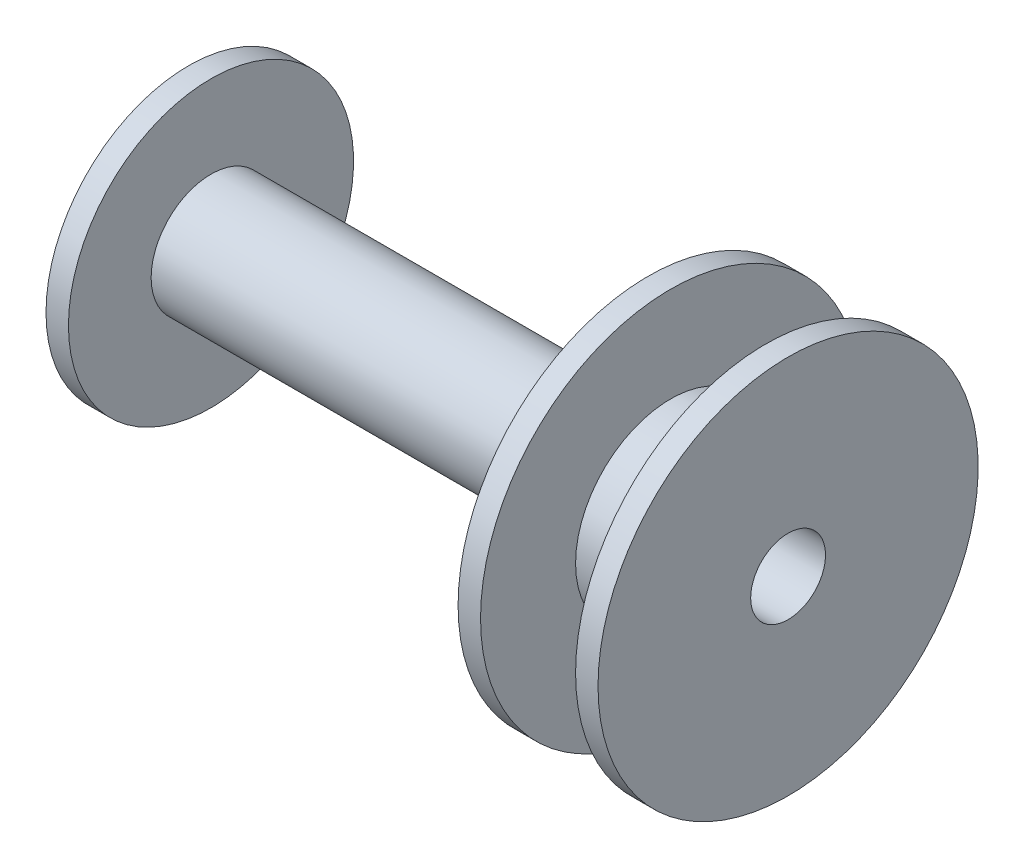
from build123d import *


with BuildPart() as part:
    # Sketch1 → Revolve1 (revolve)
    with BuildSketch(Plane.XY, mode=Mode.PRIVATE) as revolve1_sk:
        Polygon((-4.898809524, 5), (-4.898809524, 19.05), (-1.898809524, 19.05), (-1.898809524, 8), (56.521190476, 8), (56.521190476, 25.4), (59.521190476, 25.4), (59.521190476, 12.7), (72.221190476, 12.7), (72.221190476, 25.4), (75.221190476, 25.4), (75.221190476, 5), align=None)
    revolve(revolve1_sk.sketch.rotate(Axis((-22.818750637, 0, 0), (1, 0, 0)), 90), axis=Axis((-22.818750637, 0, 0), (1, 0, 0)))


solid = part.part
